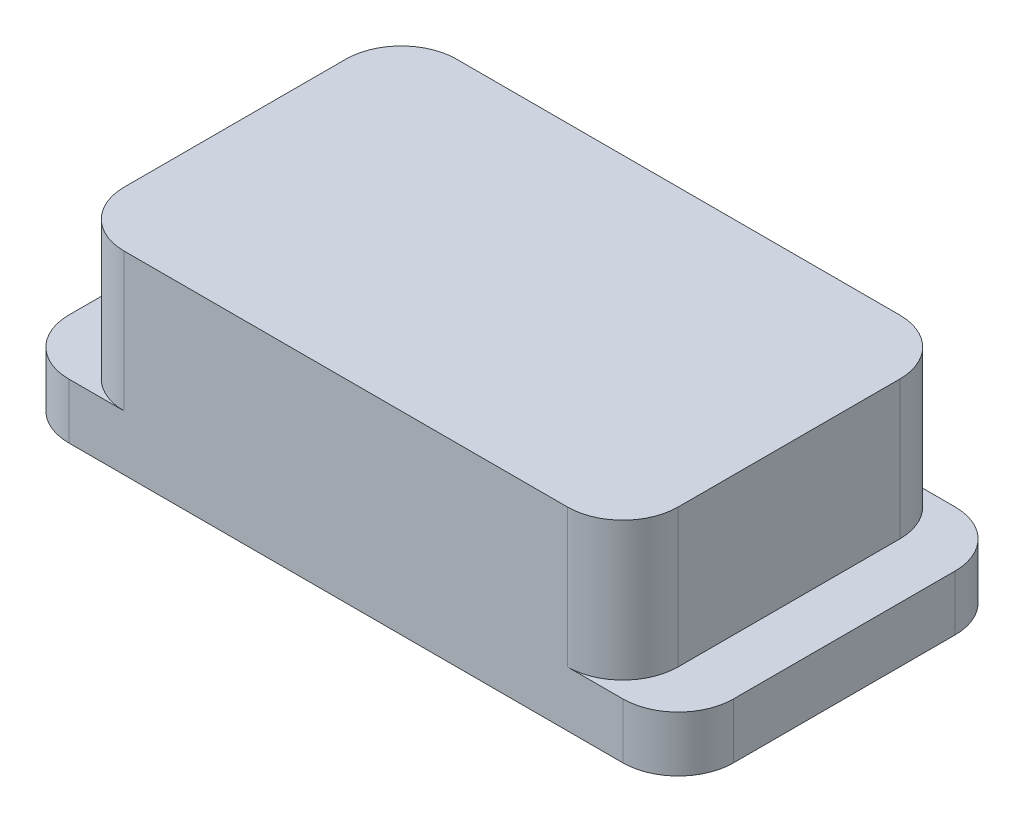
from build123d import *

# Parameters (mm, degrees)
SKETCH1_W           = 10
SKETCH1_H           = 6
BOSS_EXTRUDE1_DEPTH = 2.5
SKETCH2_W           = 12
SKETCH2_H           = 6
BOSS_EXTRUDE2_DEPTH = 1
FILLET1_R           = 1


with BuildPart() as part:
    # Sketch1 → Boss-Extrude1 (new body)
    with BuildSketch(Plane(origin=(0, 0, 0), x_dir=(1, 0, 0), z_dir=(0, 1, 0))):
        Rectangle(SKETCH1_W, SKETCH1_H)
    extrude(amount=BOSS_EXTRUDE1_DEPTH)

    # Sketch2 → Boss-Extrude2 (add)
    with BuildSketch(Plane.XZ):
        Rectangle(SKETCH2_W, SKETCH2_H)
    extrude(amount=BOSS_EXTRUDE2_DEPTH)

    # Fillet1
    fillet1_edges = [part.edges().sort_by_distance(p)[0] for p in [
        (6, -0.5, 3),
        (-6, -0.5, 3),
        (-5, 1.25, 3),
        (5, 1.25, 3),
        (6, -0.5, -3),
        (-6, -0.5, -3),
        (5, 1.25, -3),
        (-5, 1.25, -3),
    ]]
    fillet(fillet1_edges, radius=FILLET1_R)


solid = part.part
